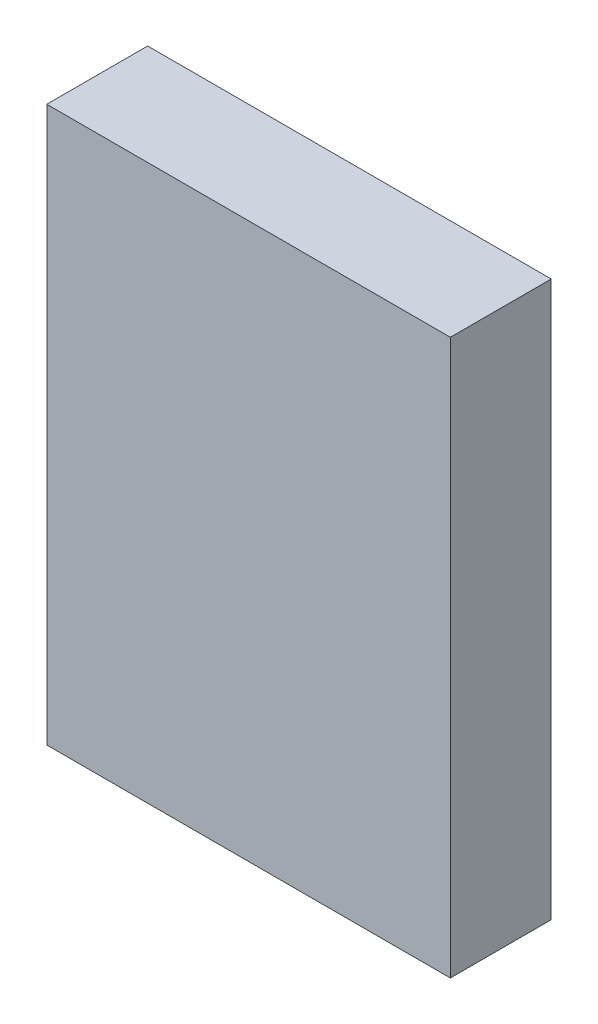
from build123d import *

# Parameters (mm, degrees)
SKETCH1_W           = 24
SKETCH1_H           = 33
BOSS_EXTRUDE1_DEPTH = 6


with BuildPart() as part:
    # Sketch1 → Boss-Extrude1 (new body)
    with BuildSketch(Plane.XY):
        Rectangle(SKETCH1_W, SKETCH1_H)
    extrude(amount=BOSS_EXTRUDE1_DEPTH)


solid = part.part
